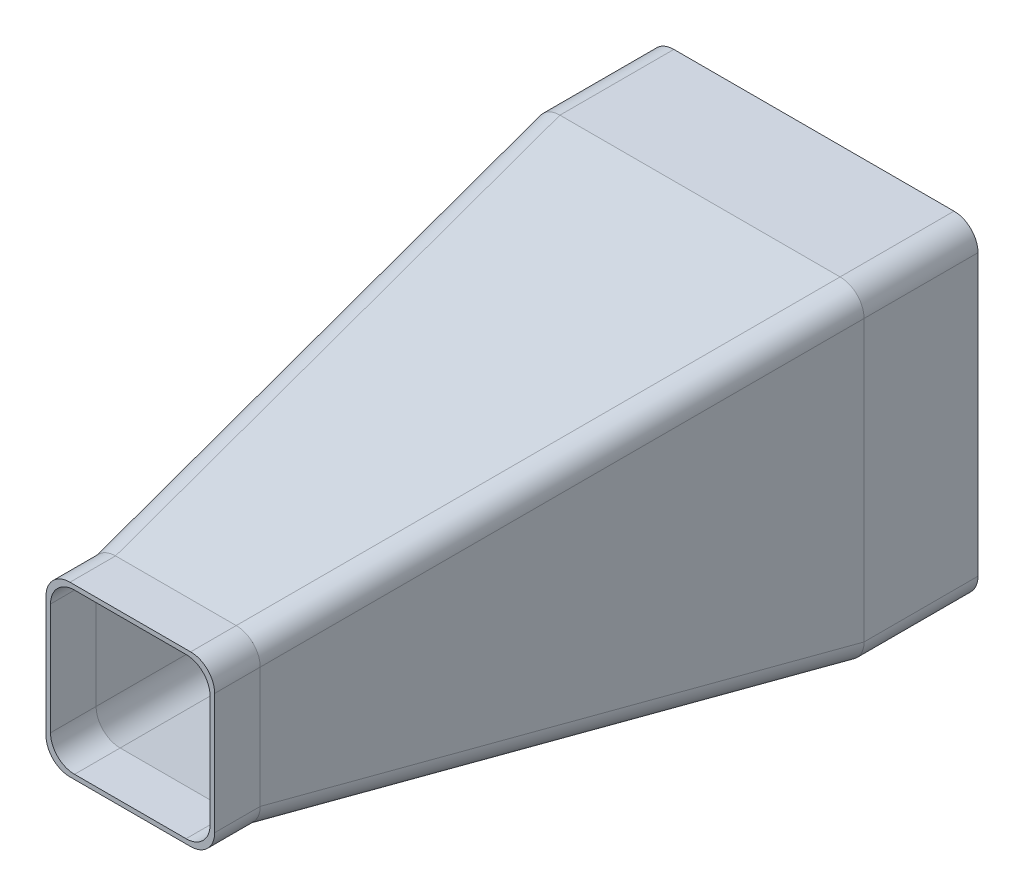
from build123d import *

# Parameters (mm, degrees)
FILLET1_R           = 10.65
BOSS_EXTRUDE1_DEPTH = 50
BOSS_EXTRUDE2_DEPTH = 20
CUT_EXTRUDE1_REACH  = 217.742
SKETCH5_R           = 2.5


with BuildPart() as part:
    # Sketch1 → Loft1 section 0
    with BuildSketch(Plane.XY.offset(130)):
        with BuildLine():
            Line((-37, -37), (37, -37))
            Line((37, -37), (37, 37))
            Line((37, 37), (-37, 37))
            Line((-37, 37), (-37, -37))
        make_face()
    # Sketch2 → Loft1 section 1
    with BuildSketch(Plane.XY.offset(-100)):
        with BuildLine():
            Line((-72, -72), (72, -72))
            Line((72, -72), (72, 72))
            Line((72, 72), (-72, 72))
            Line((-72, 72), (-72, -72))
        make_face()
    loft()

    # Sketch1<29> → Cut-Loft1 section 0
    with BuildSketch(Plane.XY.offset(130)):
        with BuildLine():
            Line((-35, -35), (35, -35))
            Line((35, -35), (35, 35))
            Line((35, 35), (-35, 35))
            Line((-35, 35), (-35, -35))
        make_face()
    # Sketch2<45> → Cut-Loft1 section 1
    with BuildSketch(Plane.XY.offset(-100)):
        with BuildLine():
            Line((-70, -70), (70, -70))
            Line((70, -70), (70, 70))
            Line((70, 70), (-70, 70))
            Line((-70, 70), (-70, -70))
        make_face()
    loft(mode=Mode.SUBTRACT)

    # Fillet1
    fillet1_edges = [part.edges().sort_by_distance(p)[0] for p in [
        (52.5, -52.5, 15),
        (-54.5, -54.5, 15),
        (52.5, 52.5, 15),
        (-52.5, 52.5, 15),
        (54.5, -54.5, 15),
        (-54.5, 54.5, 15),
        (54.5, 54.5, 15),
        (-52.5, -52.5, 15),
    ]]
    fillet(fillet1_edges, radius=FILLET1_R)

    # Sketch3 → Boss-Extrude1 (add)
    with BuildSketch(Plane(origin=(0, 0, -100), x_dir=(-1, 0, 0), z_dir=(0, 0, -1))):
        with BuildLine():
            Line((-61.471209382, -72), (61.471209382, -72))
            add(Edge.make_bspline(
                [(61.471209382, -72), (72, -72), (72, -61.471209382)],
                knots=[2.367511854, 2.367511854, 2.367511854, 3.915673453, 3.915673453, 3.915673453], degree=2, weights=[1, 0.715063911, 1]))
            Line((72, -61.471209382), (72, 61.471209382))
            add(Edge.make_bspline(
                [(72, 61.471209382), (72, 72), (61.471209382, 72)],
                knots=[5.509104507, 5.509104507, 5.509104507, 7.057266107, 7.057266107, 7.057266107], degree=2, weights=[1, 0.715063911, 1]))
            Line((61.471209382, 72), (-61.471209382, 72))
            add(Edge.make_bspline(
                [(-61.471209382, 72), (-72, 72), (-72, 61.471209382)],
                knots=[5.509104507, 5.509104507, 5.509104507, 7.057266107, 7.057266107, 7.057266107], degree=2, weights=[1, 0.715063911, 1]))
            Line((-72, 61.471209382), (-72, -61.471209382))
            add(Edge.make_bspline(
                [(-72, -61.471209382), (-72, -72), (-61.471209382, -72)],
                knots=[5.509104507, 5.509104507, 5.509104507, 7.057266107, 7.057266107, 7.057266107], degree=2, weights=[1, 0.715063911, 1]))
        make_face()
        with BuildLine():
            Line((59.471209382, -70), (-59.471209382, -70))
            add(Edge.make_bspline(
                [(-70, -59.471209382), (-70, -70), (-59.471209382, -70)],
                knots=[2.367511854, 2.367511854, 2.367511854, 3.915673453, 3.915673453, 3.915673453], degree=2, weights=[1, 0.715063911, 1]))
            Line((-70, -59.471209382), (-70, 59.471209382))
            add(Edge.make_bspline(
                [(-59.471209382, 70), (-70, 70), (-70, 59.471209382)],
                knots=[5.509104507, 5.509104507, 5.509104507, 7.057266107, 7.057266107, 7.057266107], degree=2, weights=[1, 0.715063911, 1]))
            Line((-59.471209382, 70), (59.471209382, 70))
            add(Edge.make_bspline(
                [(70, 59.471209382), (70, 70), (59.471209382, 70)],
                knots=[5.509104507, 5.509104507, 5.509104507, 7.057266107, 7.057266107, 7.057266107], degree=2, weights=[1, 0.715063911, 1]))
            Line((70, 59.471209382), (70, -59.471209382))
            add(Edge.make_bspline(
                [(59.471209382, -70), (70, -70), (70, -59.471209382)],
                knots=[5.509104507, 5.509104507, 5.509104507, 7.057266107, 7.057266107, 7.057266107], degree=2, weights=[1, 0.715063911, 1]))
        make_face(mode=Mode.SUBTRACT)
    extrude(amount=BOSS_EXTRUDE1_DEPTH)

    # Sketch4 → Boss-Extrude2 (add)
    with BuildSketch(Plane.XY.offset(130)):
        with BuildLine():
            Line((-37, 26.471209382), (-37, -26.471209382))
            add(Edge.make_bspline(
                [(-37, -26.471209382), (-37, -37), (-26.471209382, -37)],
                knots=[5.509104507, 5.509104507, 5.509104507, 7.057266107, 7.057266107, 7.057266107], degree=2, weights=[1, 0.715063911, 1]))
            Line((-26.471209382, -37), (26.471209382, -37))
            add(Edge.make_bspline(
                [(26.471209382, -37), (37, -37), (37, -26.471209382)],
                knots=[5.509104507, 5.509104507, 5.509104507, 7.057266107, 7.057266107, 7.057266107], degree=2, weights=[1, 0.715063911, 1]))
            Line((37, -26.471209382), (37, 26.471209382))
            add(Edge.make_bspline(
                [(37, 26.471209382), (37, 37), (26.471209382, 37)],
                knots=[2.367511854, 2.367511854, 2.367511854, 3.915673453, 3.915673453, 3.915673453], degree=2, weights=[1, 0.715063911, 1]))
            Line((26.471209382, 37), (-26.471209382, 37))
            add(Edge.make_bspline(
                [(-26.471209382, 37), (-37, 37), (-37, 26.471209382)],
                knots=[5.509104507, 5.509104507, 5.509104507, 7.057266107, 7.057266107, 7.057266107], degree=2, weights=[1, 0.715063911, 1]))
        make_face()
        with BuildLine():
            Line((-24.471209382, -35), (24.471209382, -35))
            add(Edge.make_bspline(
                [(24.471209382, -35), (35, -35), (35, -24.471209382)],
                knots=[2.367511854, 2.367511854, 2.367511854, 3.915673453, 3.915673453, 3.915673453], degree=2, weights=[1, 0.715063911, 1]))
            Line((35, -24.471209382), (35, 24.471209382))
            add(Edge.make_bspline(
                [(35, 24.471209382), (35, 35), (24.471209382, 35)],
                knots=[5.509104507, 5.509104507, 5.509104507, 7.057266107, 7.057266107, 7.057266107], degree=2, weights=[1, 0.715063911, 1]))
            Line((24.471209382, 35), (-24.471209382, 35))
            add(Edge.make_bspline(
                [(-24.471209382, 35), (-35, 35), (-35, 24.471209382)],
                knots=[5.509104507, 5.509104507, 5.509104507, 7.057266107, 7.057266107, 7.057266107], degree=2, weights=[1, 0.715063911, 1]))
            Line((-35, 24.471209382), (-35, -24.471209382))
            add(Edge.make_bspline(
                [(-35, -24.471209382), (-35, -35), (-24.471209382, -35)],
                knots=[5.509104507, 5.509104507, 5.509104507, 7.057266107, 7.057266107, 7.057266107], degree=2, weights=[1, 0.715063911, 1]))
        make_face(mode=Mode.SUBTRACT)
    extrude(amount=BOSS_EXTRUDE2_DEPTH)

    # Sketch5 → Cut-Extrude1 (cut, up to next)
    with BuildSketch(Plane(origin=(0, -55.497459584, 8.445265589), x_dir=(1, 0, 0), z_dir=(0, -0.9886188373396115, 0.15044199698646277)), mode=Mode.PRIVATE) as cut_extrude1_sk1:
        with Locations(Location((0, 89.693707517, 0), (0, 0, 270))):
            Circle(SKETCH5_R)
    cut_extrude1_tool1 = extrude(cut_extrude1_sk1.sketch, amount=-CUT_EXTRUDE1_REACH, mode=Mode.PRIVATE) & part.part
    # Sketch5 → Cut-Extrude1 (cut, up to next)
    with BuildSketch(Plane(origin=(0, -55.497459584, 8.445265589), x_dir=(1, 0, 0), z_dir=(0, -0.9886188373396115, 0.15044199698646277)), mode=Mode.PRIVATE) as cut_extrude1_sk2:
        with Locations(Location((0, 0, 0), (0, 0, 270))):
            Circle(SKETCH5_R)
    cut_extrude1_tool2 = extrude(cut_extrude1_sk2.sketch, amount=-CUT_EXTRUDE1_REACH, mode=Mode.PRIVATE) & part.part
    # Sketch5 → Cut-Extrude1 (cut, up to next)
    with BuildSketch(Plane(origin=(0, -55.497459584, 8.445265589), x_dir=(1, 0, 0), z_dir=(0, -0.9886188373396115, 0.15044199698646277)), mode=Mode.PRIVATE) as cut_extrude1_sk3:
        with Locations(Location((0, -89.693707517, 0), (0, 0, 270))):
            Circle(SKETCH5_R)
    cut_extrude1_tool3 = extrude(cut_extrude1_sk3.sketch, amount=-CUT_EXTRUDE1_REACH, mode=Mode.PRIVATE) & part.part
    add(cut_extrude1_tool1.solids().sort_by_distance((0, -42.003759, 97.118154))[0], mode=Mode.SUBTRACT)
    add(cut_extrude1_tool2.solids().sort_by_distance((0, -55.49746, 8.445266))[0], mode=Mode.SUBTRACT)
    add(cut_extrude1_tool3.solids().sort_by_distance((0, -68.99116, -80.227623))[0], mode=Mode.SUBTRACT)


solid = part.part
